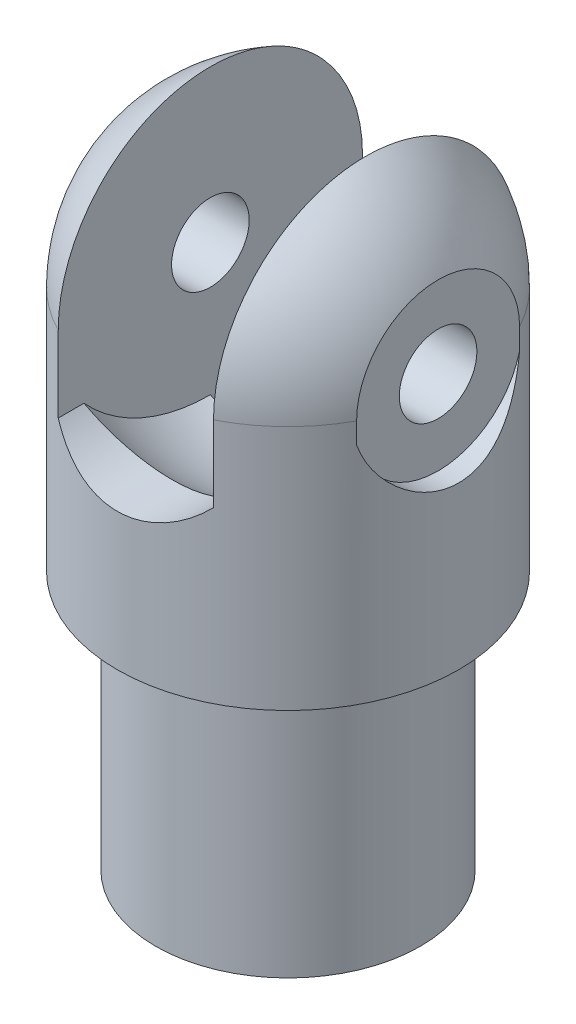
from build123d import *

# Parameters (mm, degrees)
SKETCH1_R               = 12.9921
BOSS_EXTRUDE1_DEPTH     = 25.4
CUT_EXTRUDE1_DEPTH      = 71.405666164
CUT_EXTRUDE1_DEPTH_BACK = 71.405666164
SKETCH3_R               = 3.81
CUT_REVOLVE1_ANGLE      = 270
CUT_REVOLVE2_ANGLE      = 270
SKETCH6_R               = 8.255
CUT_EXTRUDE2_DEPTH      = 2.032
CUT_EXTRUDE3_DEPTH      = 24.638


with BuildPart() as part:
    # Sketch1 → Boss-Extrude1 (new body)
    with BuildSketch(Plane(origin=(0, 0, 0), x_dir=(1, 0, 0), z_dir=(0, 1, 0))):
        with Locations(Location((0, 0, 0), (0, 0, 270))):
            Circle(SKETCH1_R)
    extrude(amount=BOSS_EXTRUDE1_DEPTH)

    # Sketch2 → Revolve1 (revolve)
    with BuildSketch(Plane(origin=(0, 0, 0), x_dir=(0, 0, -1), z_dir=(1, 0, 0))):
        with BuildLine():
            Line((-16.764, 25.4), (-16.764, 49.53))
            ThreePointArc((-16.764, 49.53), (-11.85393808, 61.38393808), (0, 66.294))
            Line((0, 66.294), (0, 25.4))
            Line((0, 25.4), (-16.764, 25.4))
        make_face()
    revolve(axis=Axis((0, 25.4, 0), (0, 1, 0)))

    # Sketch3 → Cut-Extrude1 (cut, two sides: drawn at the far end of the back side and taken through both)
    with BuildSketch(Plane(origin=(0, 0, 0), x_dir=(0, 0, -1), z_dir=(1, 0, 0)).offset(-CUT_EXTRUDE1_DEPTH_BACK)):
        with Locations((0, 49.53)):
            Circle(SKETCH3_R)
    extrude(amount=CUT_EXTRUDE1_DEPTH + CUT_EXTRUDE1_DEPTH_BACK, mode=Mode.SUBTRACT)

    # Sketch4 → Cut-Revolve1 (revolve, cut)
    with BuildSketch(Plane.XY):
        with BuildLine():
            Line((-7.62, 32.995439638), (-7.62, 49.53))
            Line((-7.62, 49.53), (7.62, 49.53))
            Line((7.62, 49.53), (7.62, 32.995439638))
            ThreePointArc((7.62, 32.995439638), (0, 31.32406453), (-7.62, 32.995439638))
        make_face()
    revolve(axis=Axis((-7.62, 49.53, 0), (1, 0, 0)), revolution_arc=CUT_REVOLVE1_ANGLE, mode=Mode.SUBTRACT)

    # Sketch5 → Cut-Revolve2 (revolve, cut)
    with BuildSketch(Plane.XY):
        with BuildLine():
            Line((7.62, 53.34), (-7.62, 53.34))
            Line((-7.62, 53.34), (-7.62, 36.575518946))
            ThreePointArc((-7.62, 36.575518946), (0, 34.925), (7.62, 36.575518946))
            Line((7.62, 36.575518946), (7.62, 53.34))
        make_face()
    revolve(axis=Axis((7.62, 53.34, 0), (-1, 0, 0)), revolution_arc=CUT_REVOLVE2_ANGLE, mode=Mode.SUBTRACT)

    # Sketch6 → Cut-Extrude2 (cut)
    with BuildSketch(Plane(origin=(16.764, 0, 0), x_dir=(0, 0, -1), z_dir=(1, 0, 0))):
        with Locations((0, 49.53)):
            Circle(SKETCH6_R)
    cut_extrude2 = extrude(amount=-CUT_EXTRUDE2_DEPTH, mode=Mode.SUBTRACT)

    # Mirror1: Cut-Extrude2 across plane
    add(cut_extrude2.mirror(Plane(origin=(0, 0, 0), x_dir=(0, 0, 1), z_dir=(1, 0, 0))), mode=Mode.SUBTRACT)

    # Sketch7 → Cut-Extrude3 (cut)
    with BuildSketch(Plane.XY):
        with BuildLine():
            Line((-7.62, 49.53), (-7.62, 42.063955264))
            ThreePointArc((-7.62, 42.063955264), (0, 38.862), (7.62, 42.063955264))
            Line((7.62, 42.063955264), (7.62, 49.53))
            Line((7.62, 49.53), (-7.62, 49.53))
        make_face()
    extrude(amount=CUT_EXTRUDE3_DEPTH, mode=Mode.SUBTRACT)


solid = part.part
